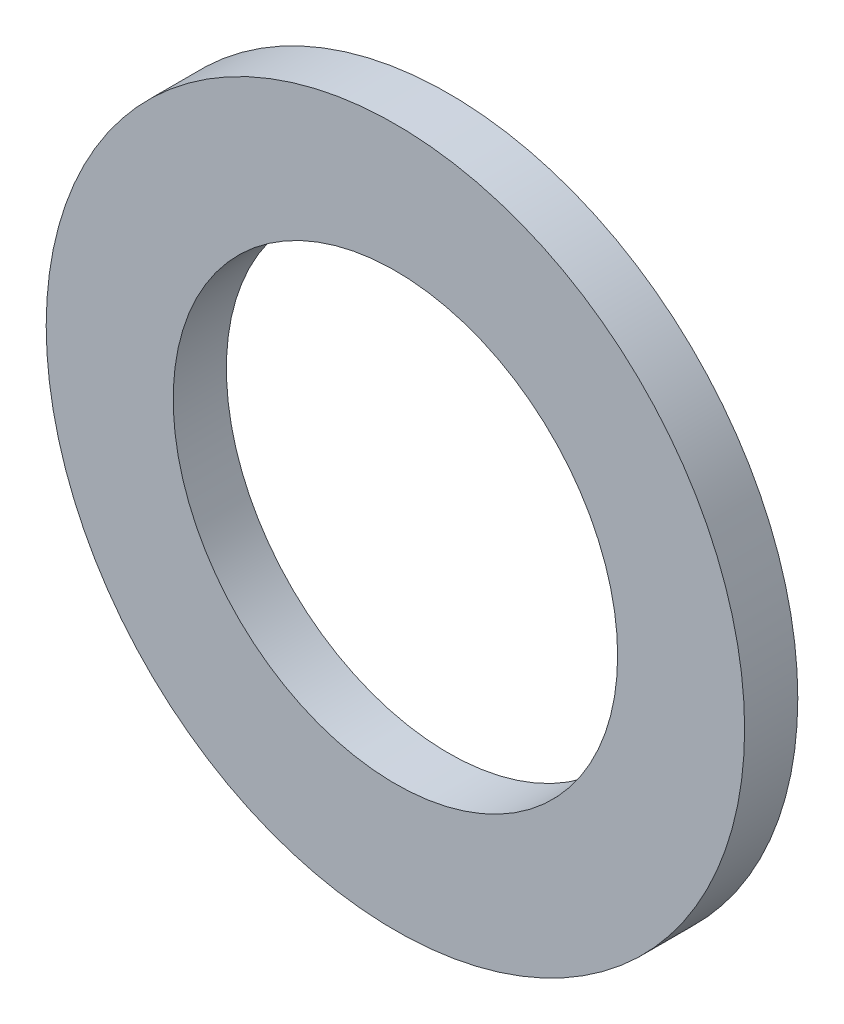
from build123d import *

# Parameters (mm, degrees)
IZIM1_R               = 22
IZIM1_R_2             = 14
EKSTR_ZYON_NCE1_DEPTH = 3.35


with BuildPart() as part:
    # Çizim1 → Ekstrüzyon-İnce1 (new body)
    with BuildSketch(Plane.XY):
        Circle(IZIM1_R)
        Circle(IZIM1_R_2, mode=Mode.SUBTRACT)
    extrude(amount=EKSTR_ZYON_NCE1_DEPTH)


solid = part.part
